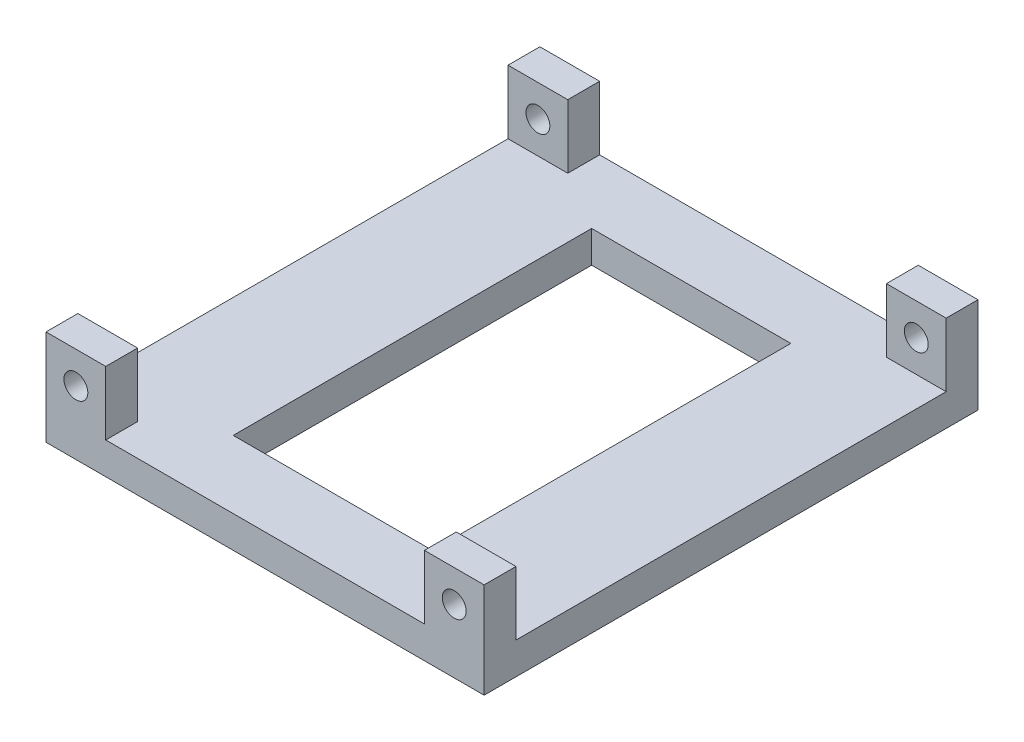
from build123d import *

# Parameters (mm, degrees)
SKETCH1_W           = 55
SKETCH1_H           = 62
SKETCH1_W_2         = 25
SKETCH1_H_2         = 45
BOSS_EXTRUDE1_DEPTH = 4
SKETCH2_W           = 7.5
SKETCH2_H           = 8
SKETCH2_R           = 1.5
BOSS_EXTRUDE2_DEPTH = 4


with BuildPart() as part:
    # Sketch1 → Boss-Extrude1 (new body)
    with BuildSketch(Plane(origin=(0, 0, 0), x_dir=(1, 0, 0), z_dir=(0, 1, 0))):
        Rectangle(SKETCH1_W, SKETCH1_H)
        Rectangle(SKETCH1_W_2, SKETCH1_H_2, mode=Mode.SUBTRACT)
    extrude(amount=BOSS_EXTRUDE1_DEPTH)

    # Sketch2 → Boss-Extrude2 (add)
    # profile 1 of 2: a face of its own
    with BuildSketch(Plane.XY.offset(31)):
        with Locations((-23.75, 8)):
            Rectangle(SKETCH2_W, SKETCH2_H)
        with Locations((-23.75, 8)):
            Circle(SKETCH2_R, mode=Mode.SUBTRACT)
    # profile 2 of 2: a face of its own
    with BuildSketch(Plane.XY.offset(31)):
        with Locations((23.75, 8)):
            Rectangle(SKETCH2_W, SKETCH2_H)
        with Locations(Location((23.75, 8, 0), (0, 0, 180))):
            Circle(SKETCH2_R, mode=Mode.SUBTRACT)
    boss_extrude2 = extrude(amount=-BOSS_EXTRUDE2_DEPTH)

    # Mirror1: Boss-Extrude2 across plane
    add(boss_extrude2.mirror(Plane.XY))


solid = part.part
